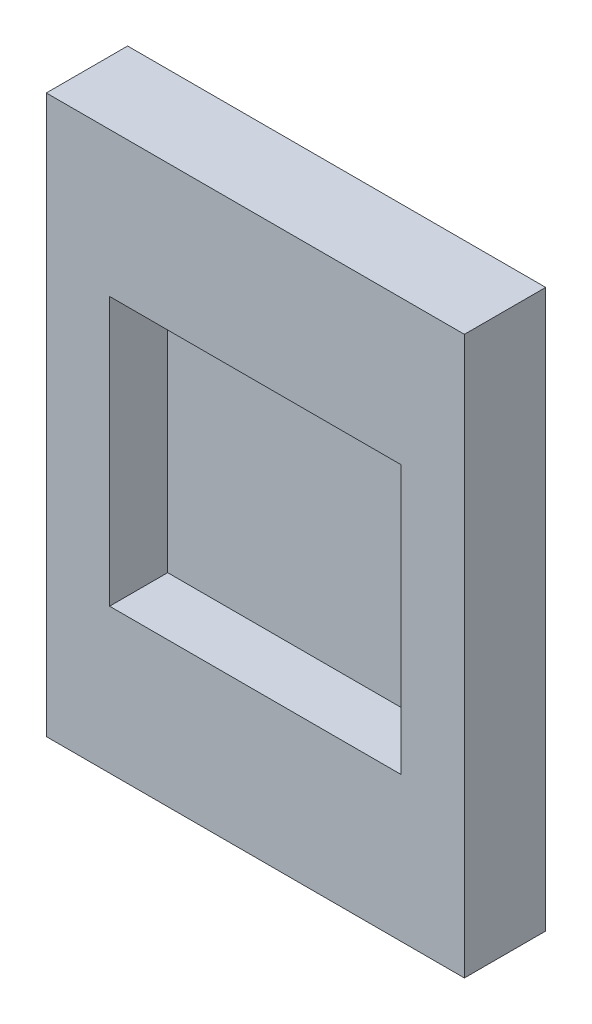
from build123d import *

# Parameters (mm, degrees)
SKETCH_1_W          = 18
SKETCH_1_H          = 24
EXTRUDE_1_DEPTH     = 3.5
SKETCH_2_W          = 12.55
SKETCH_2_H          = 11.55
CUT_EXTRUDE_1_DEPTH = 2.5


with BuildPart() as part:
    # 스케치1 → 보스-돌출1 (new body)
    with BuildSketch(Plane.XY):
        Rectangle(SKETCH_1_W, SKETCH_1_H)
    extrude(amount=EXTRUDE_1_DEPTH)

    # 스케치2 → 컷-돌출1 (cut)
    with BuildSketch(Plane.XY.offset(3.5)):
        Rectangle(SKETCH_2_W, SKETCH_2_H)
    extrude(amount=-CUT_EXTRUDE_1_DEPTH, mode=Mode.SUBTRACT)


solid = part.part
